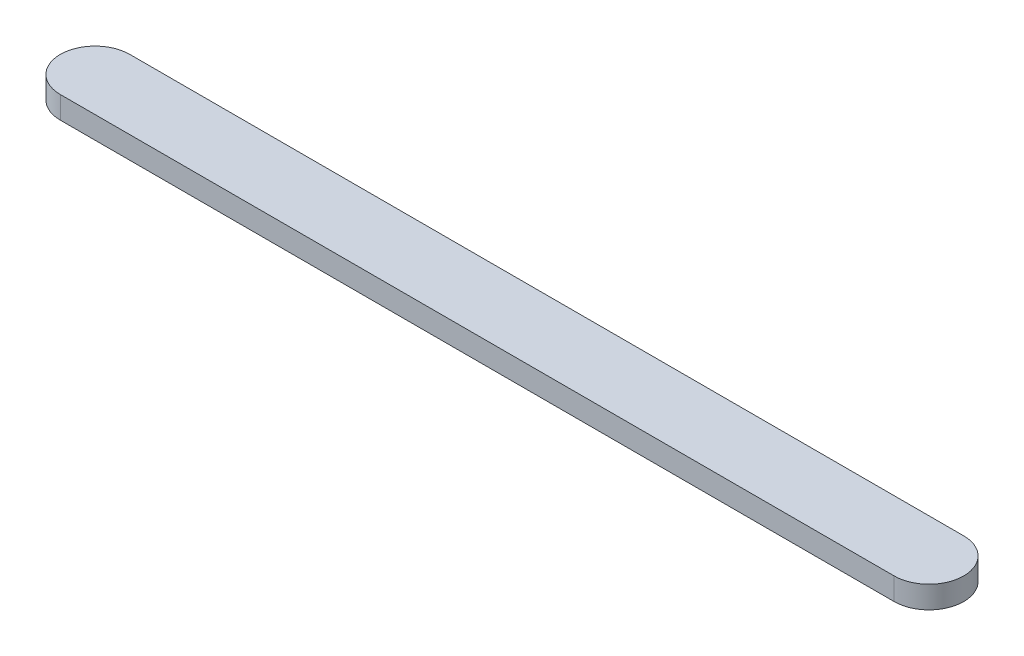
from build123d import *

# Parameters (mm, degrees)
BOSS_EXTRUDE1_DEPTH = 2.032


with BuildPart() as part:
    # Sketch2 → Boss-Extrude1 (new body)
    with BuildSketch(Plane(origin=(0, 0, 0), x_dir=(1, 0, 0), z_dir=(0, 1, 0))):
        with BuildLine():
            Line((-39.679223149, 3.175), (36.520776851, 3.175))
            ThreePointArc((36.520776851, 3.175), (39.695776851, 0), (36.520776851, -3.175))
            Line((36.520776851, -3.175), (-39.679223149, -3.175))
            ThreePointArc((-39.679223149, -3.175), (-42.854223149, 0), (-39.679223149, 3.175))
        make_face()
    extrude(amount=BOSS_EXTRUDE1_DEPTH)


solid = part.part
